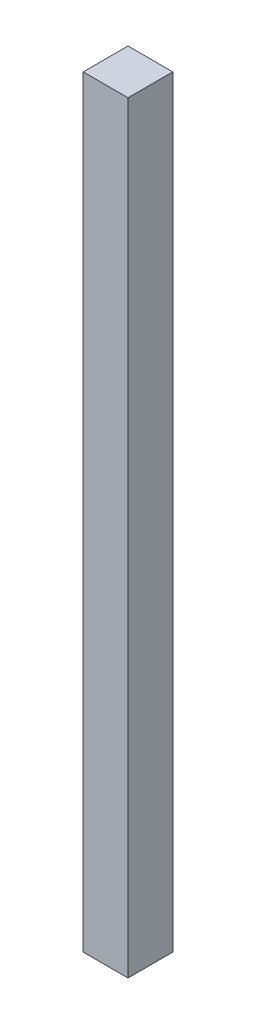
from build123d import *

# Parameters (mm, degrees)
SKETCH1_W           = 25.4
SKETCH1_H           = 25.4
BOSS_EXTRUDE1_DEPTH = 431.8


with BuildPart() as part:
    # Sketch1 → Boss-Extrude1 (new body)
    with BuildSketch(Plane(origin=(0, 0, 0), x_dir=(1, 0, 0), z_dir=(0, 1, 0))):
        with Locations((12.7, 12.7)):
            Rectangle(SKETCH1_W, SKETCH1_H)
    extrude(amount=BOSS_EXTRUDE1_DEPTH)


solid = part.part
